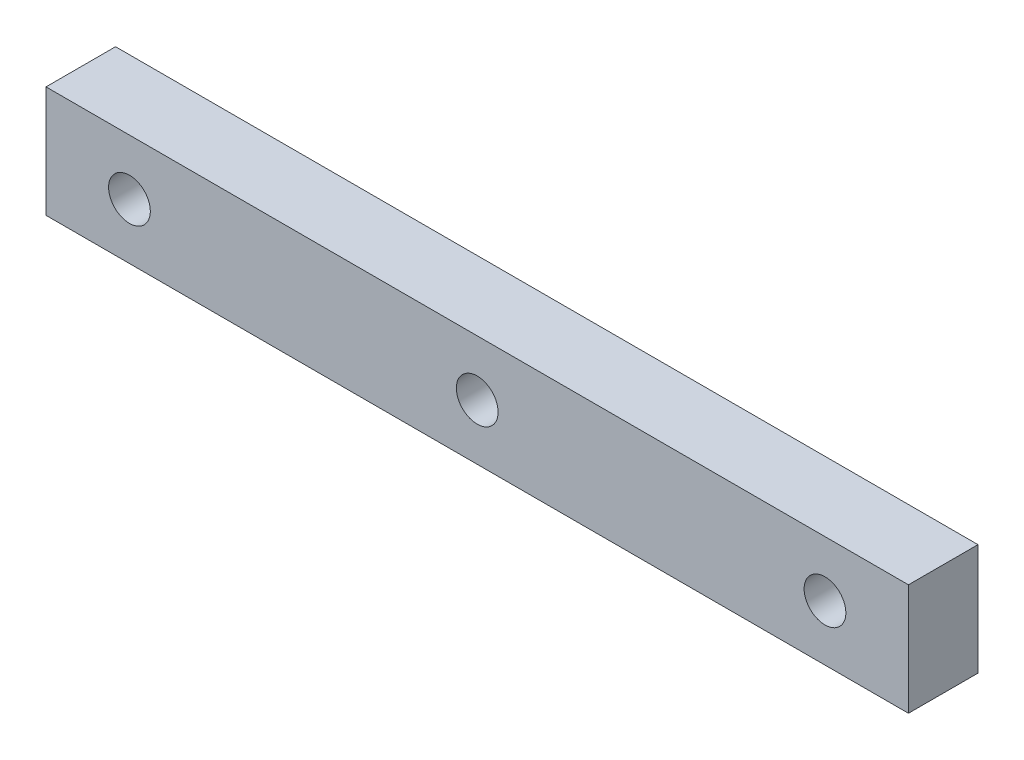
from build123d import *

# Parameters (mm, degrees)
SKETCH1_W           = 62
SKETCH1_H           = 8
BOSS_EXTRUDE1_DEPTH = 5
SKETCH2_R           = 1.5
CUT_EXTRUDE1_DEPTH  = 10


with BuildPart() as part:
    # Sketch1 → Boss-Extrude1 (new body)
    with BuildSketch(Plane.XY):
        Rectangle(SKETCH1_W, SKETCH1_H)
    extrude(amount=BOSS_EXTRUDE1_DEPTH)

    # Sketch2 → Cut-Extrude1 (cut)
    with BuildSketch(Plane(origin=(0, 0, 0), x_dir=(-1, 0, 0), z_dir=(0, 0, -1))):
        with Locations((-25, 0)):
            Circle(SKETCH2_R)
        Circle(SKETCH2_R)
        with Locations((25, 0)):
            Circle(SKETCH2_R)
    extrude(amount=-CUT_EXTRUDE1_DEPTH, mode=Mode.SUBTRACT)


solid = part.part
